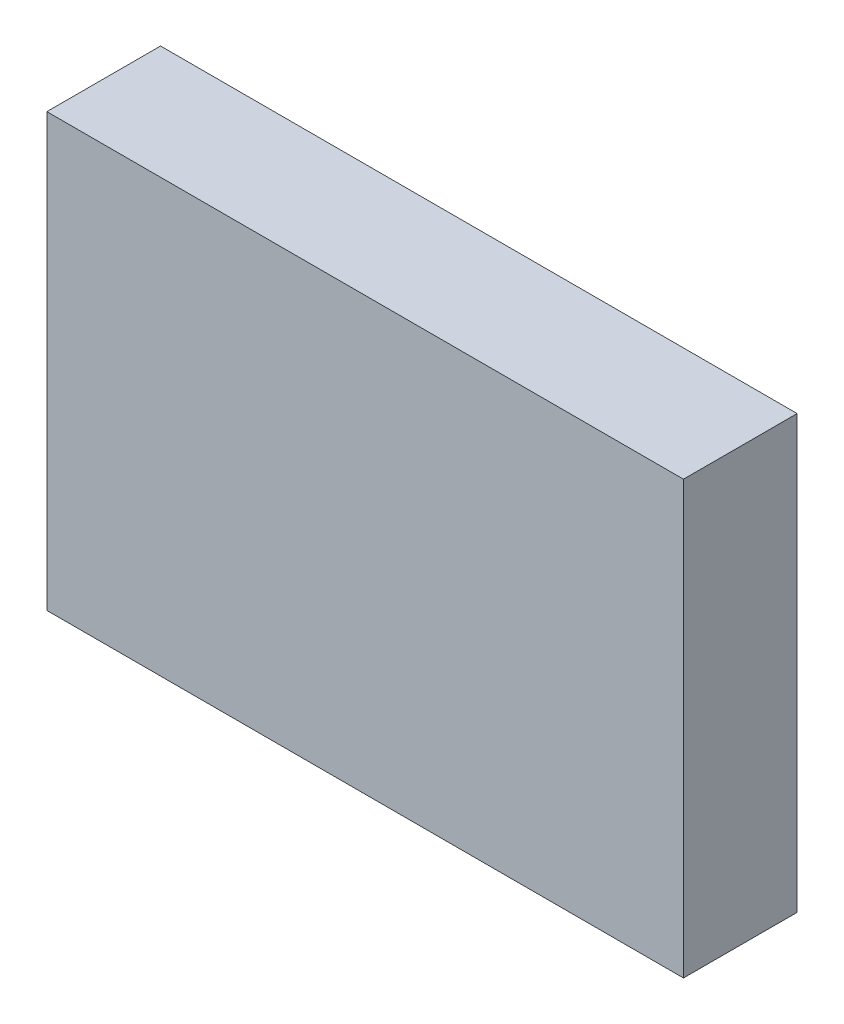
from build123d import *

# Parameters (mm, degrees)
SKETCH_1_W      = 140
SKETCH_1_H      = 95
EXTRUDE_1_DEPTH = 25


with BuildPart() as part:
    # 草图1 → 凸台-拉伸1 (new body)
    with BuildSketch(Plane.XY):
        Rectangle(SKETCH_1_W, SKETCH_1_H)
    extrude(amount=EXTRUDE_1_DEPTH)


solid = part.part
